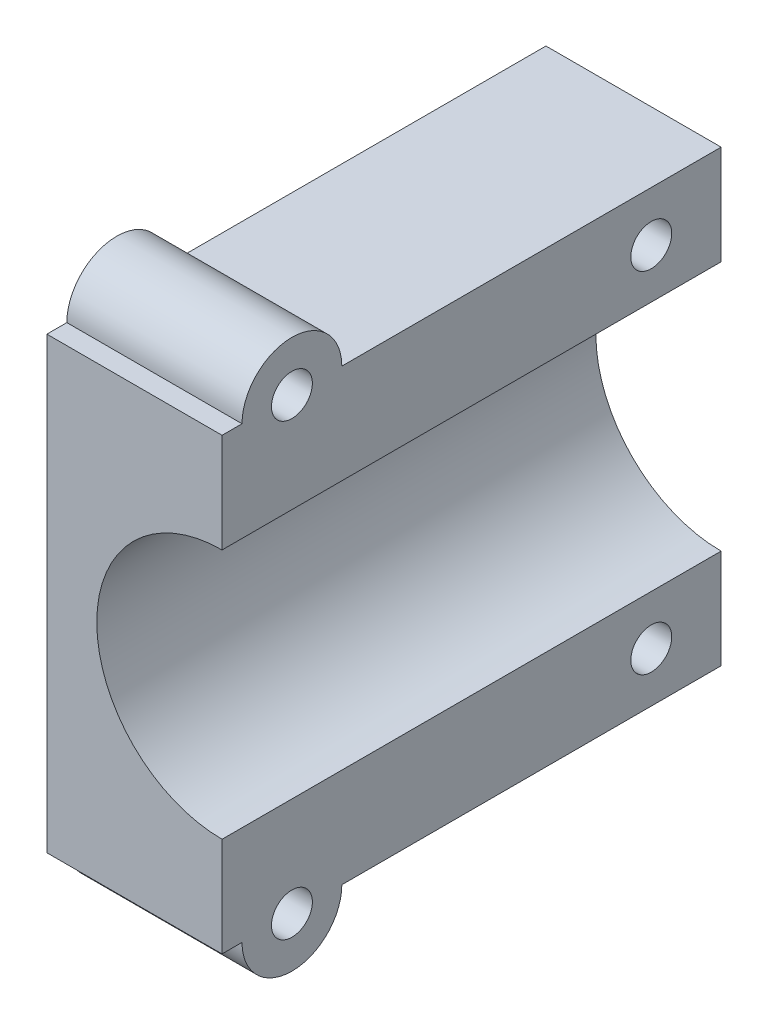
from build123d import *
from build123d.topology import SkipClean

# Parameters (mm, degrees)
BOSS_EXTRUDE1_DEPTH             = 25
BOSS_EXTRUDE2_REACH             = 65.436
BOSS_EXTRUDE2_DIRECTION_2_DEPTH = 30
SKETCH9_R                       = 2.05
CUT_EXTRUDE3_DEPTH              = 35.1
BOSS_EXTRUDE5_REACH             = 63.632
SKETCH13_R                      = 1.55
CUT_EXTRUDE4_DEPTH              = 88.768186926
SKETCH16_W                      = 63
SKETCH16_H                      = 45
CUT_EXTRUDE5_DEPTH              = 65.271143
BOSS_EXTRUDE6_DEPTH             = 17.55
SKETCH18_R                      = 2.05
CUT_EXTRUDE6_DEPTH              = 17.55


with BuildPart() as part:
    # Sketch1 → Boss-Extrude1 (new, symmetric)
    with BuildSketch(Plane.XY):
        with BuildLine():
            Line((-17.55, 22.5), (-17.55, 0))
            Line((-17.55, 0), (17.55, 0))
            Line((17.55, 0), (17.55, 22.5))
            Line((17.55, 22.5), (12.55, 22.5))
            ThreePointArc((12.55, 22.5), (0, 9.95), (-12.55, 22.5))
            Line((-12.55, 22.5), (-17.55, 22.5))
        make_face()
    boss_extrude1 = extrude(amount=BOSS_EXTRUDE1_DEPTH, both=True)

    # Boss-Extrude2: up to this face of the body (flat: up to its plane)
    boss_extrude2_end = Plane(part.part.faces().sort_by_distance((17.55, 11.25, 0))[0])
    # Sketch5 → Boss-Extrude2 (add, up to the picked face)
    with BuildSketch(Plane(origin=(26.152881057, 0, 15.099372918), x_dir=(0.500000000000001, 0, -0.8660254037844382), z_dir=(0.8660254037844382, 0, 0.500000000000001)), mode=Mode.PRIVATE) as boss_extrude2_sk1:
        with BuildLine():
            Line((-8.725, 22.5), (-3.775, 22.5))
            ThreePointArc((-3.775, 22.5), (8.775, 9.95), (21.325, 22.5))
            Line((21.325, 22.5), (26.275, 22.5))
            ThreePointArc((26.275, 22.5), (8.775, 5), (-8.725, 22.5))
        make_face()
    boss_extrude2_tool1 = split(extrude(boss_extrude2_sk1.sketch, amount=-BOSS_EXTRUDE2_REACH, mode=Mode.PRIVATE), bisect_by=boss_extrude2_end, keep=Keep.BOTH, mode=Mode.PRIVATE)
    boss_extrude2 = boss_extrude2_tool1.solids().sort_by(Axis((23.027881, 22.108688, 20.512032), (-0.8660254037844382, 0, -0.500000000000001)))[0]
    add(boss_extrude2)

    # Sketch5 → Boss-Extrude2 direction 2 (add)
    with BuildSketch(Plane(origin=(26.152881057, 0, 15.099372918), x_dir=(0.500000000000001, 0, -0.8660254037844382), z_dir=(0.8660254037844382, 0, 0.500000000000001))):
        with BuildLine():
            Line((-8.725, 22.5), (-3.775, 22.5))
            ThreePointArc((-3.775, 22.5), (8.775, 9.95), (21.325, 22.5))
            Line((21.325, 22.5), (26.275, 22.5))
            ThreePointArc((26.275, 22.5), (8.775, 5), (-8.725, 22.5))
        make_face()
    boss_extrude2_direction_2 = extrude(amount=BOSS_EXTRUDE2_DIRECTION_2_DEPTH)

    # Sketch9 → Cut-Extrude3 (cut)
    with BuildSketch(Plane.ZY.offset(17.55)):
        with Locations((-18, 5)):
            Circle(SKETCH9_R)
    cut_extrude3 = extrude(amount=-CUT_EXTRUDE3_DEPTH, mode=Mode.SUBTRACT)

    # Boss-Extrude5: up to this face of the body (flat: up to its plane)
    boss_extrude5_end = Plane(part.part.faces().sort_by_distance((17.55, 17.173614571, 0))[0])
    # Sketch12 → Boss-Extrude5 (add, up to the picked face)
    with BuildSketch(Plane(origin=(22.035576211, 0, 12.722245857), x_dir=(0.4999999999999999, 0, -0.8660254037844388), z_dir=(0.8660254037844388, 0, 0.4999999999999999)), mode=Mode.PRIVATE) as boss_extrude5_sk1:
        with BuildLine():
            Line((-3.775, 22.5), (21.325, 22.5))
            ThreePointArc((21.325, 22.5), (8.775, 9.95), (-3.775, 22.5))
        make_face()
    boss_extrude5_tool1 = split(extrude(boss_extrude5_sk1.sketch, amount=-BOSS_EXTRUDE5_REACH, mode=Mode.PRIVATE), bisect_by=boss_extrude5_end, keep=Keep.BOTH, mode=Mode.PRIVATE)
    boss_extrude5 = boss_extrude5_tool1.solids().sort_by(Axis((26.423076, 17.173615, 5.122873), (-0.8660254037844388, 0, -0.4999999999999999)))[0]
    add(boss_extrude5)

    # Mirror1: Boss-Extrude1, Boss-Extrude2, Boss-Extrude2 direction 2, Cut-Extrude3, Boss-Extrude5 across plane
    with SkipClean():  # the faces are left unmerged after this step: merging them gives an invalid solid
        add(boss_extrude1.mirror(Plane(origin=(17.55, 22.5, 25), x_dir=(0, 0, 1), z_dir=(0, -1, 0))))
        add(boss_extrude2.mirror(Plane(origin=(17.55, 22.5, 25), x_dir=(0, 0, 1), z_dir=(0, -1, 0))))
        add(boss_extrude2_direction_2.mirror(Plane(origin=(17.55, 22.5, 25), x_dir=(0, 0, 1), z_dir=(0, -1, 0))))
        add(cut_extrude3.mirror(Plane(origin=(17.55, 22.5, 25), x_dir=(0, 0, 1), z_dir=(0, -1, 0))), mode=Mode.SUBTRACT)
        add(boss_extrude5.mirror(Plane(origin=(17.55, 22.5, 25), x_dir=(0, 0, 1), z_dir=(0, -1, 0))))

    # Sketch13 → Cut-Extrude4 (cut, through all)
    with SkipClean():  # the faces are left unmerged after this step: merging them gives an invalid solid
        with BuildSketch(Plane(origin=(0, 0, 0), x_dir=(1, 0, 0), z_dir=(0, 1, 0))):
            with Locations(Location((43.530762114, -15, 0), (0, 0, 90))):
                Circle(SKETCH13_R)
        extrude(amount=CUT_EXTRUDE4_DEPTH, mode=Mode.SUBTRACT)

    # Sketch16 → Cut-Extrude5 (cut)
    with BuildSketch(Plane(origin=(0, 0, 0), x_dir=(0, 0, -1), z_dir=(1, 0, 0))):
        with Locations((-6.5, 22.5)):
            Rectangle(SKETCH16_W, SKETCH16_H)
    extrude(amount=CUT_EXTRUDE5_DEPTH, mode=Mode.SUBTRACT)

    # Sketch17 → Boss-Extrude6 (add)
    with BuildSketch(Plane.ZY.offset(17.55)):
        with BuildLine():
            Line((13, 0), (23, 0))
            ThreePointArc((23, 0), (18, -5), (13, 0))
        make_face()
    boss_extrude6 = extrude(amount=-BOSS_EXTRUDE6_DEPTH)

    # Sketch18 → Cut-Extrude6 (cut)
    with BuildSketch(Plane.ZY.offset(17.55)):
        with Locations(Location((18, 0, 0), (0, 0, 270))):
            Circle(SKETCH18_R)
    cut_extrude6 = extrude(amount=-CUT_EXTRUDE6_DEPTH, mode=Mode.SUBTRACT)

    # Mirror2: Boss-Extrude6, Cut-Extrude6 across plane
    add(boss_extrude6.mirror(Plane.ZX.offset(22.5)))
    add(cut_extrude6.mirror(Plane.ZX.offset(22.5)), mode=Mode.SUBTRACT)


solid = part.part
